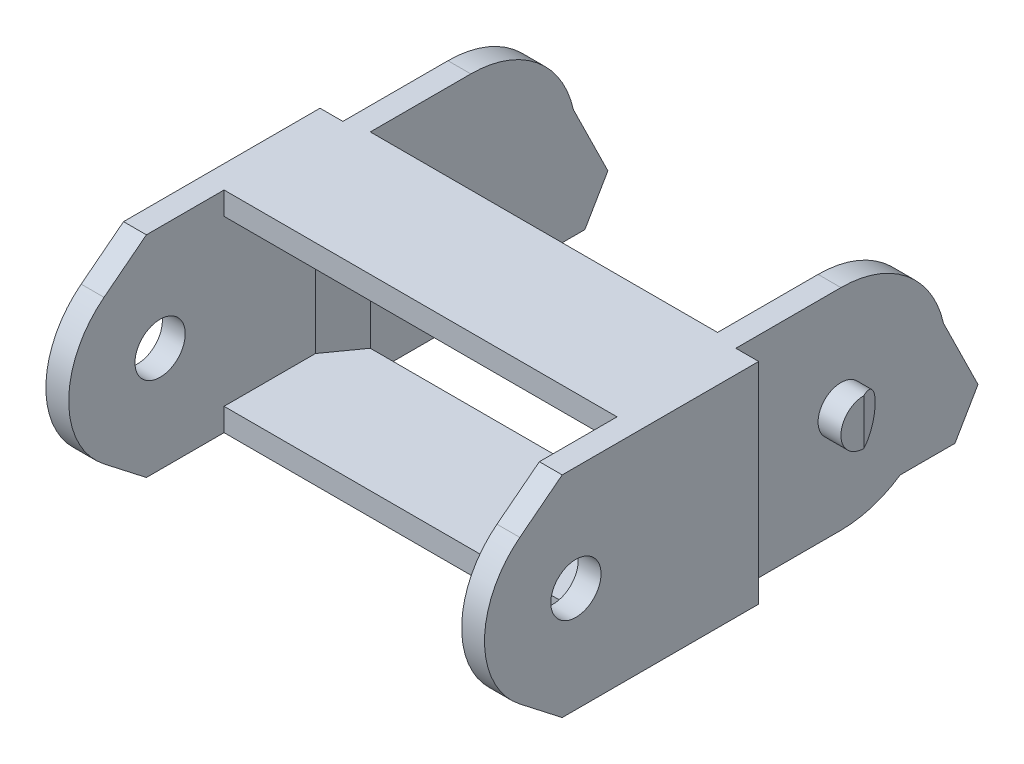
from build123d import *

# Parameters (mm, degrees)
BOSS_EXTRUDE1_DEPTH = 24
SKETCH2_W           = 23
SKETCH2_H           = 23
CUT_EXTRUDE1_DEPTH  = 2.5
SKETCH4_W           = 43
SKETCH4_H           = 17
CUT_EXTRUDE2_DEPTH  = 44.462627624
SKETCH5_W           = 38
SKETCH5_H           = 22.5
CUT_EXTRUDE3_DEPTH  = 44.462627624
CUT_EXTRUDE4_DEPTH  = 9
SKETCH7_R           = 2.75
CUT_EXTRUDE5_DEPTH  = 57.747246629
SKETCH8_R           = 2.5
BOSS_EXTRUDE2_DEPTH = 2.5
CUT_EXTRUDE6_DEPTH  = 44.462627624
BOSS_EXTRUDE4_DEPTH = 2.5


with BuildPart() as part:
    # Sketch1 → Boss-Extrude1 (new, symmetric)
    with BuildSketch(Plane(origin=(0, 0, 0), x_dir=(0, 0, -1), z_dir=(1, 0, 0))):
        with BuildLine():
            Line((16.5, -11.5), (-16.5, -11.5))
            Line((-16.5, -11.5), (-21.137338715, -7.895129733))
            ThreePointArc((-21.137338715, -7.895129733), (-25, 0), (-21.137338715, 7.895129733))
            Line((-21.137338715, 7.895129733), (-16.5, 11.5))
            Line((-16.5, 11.5), (16.5, 11.5))
            ThreePointArc((16.5, 11.5), (28, 0), (16.5, -11.5))
        make_face()
    extrude(amount=BOSS_EXTRUDE1_DEPTH, both=True)

    # Sketch2 → Cut-Extrude1 (cut)
    with BuildSketch(Plane(origin=(24, 0, 0), x_dir=(0, 0, -1), z_dir=(1, 0, 0))):
        with Locations((16.5, 0)):
            Rectangle(SKETCH2_W, SKETCH2_H)
    cut_extrude1 = extrude(amount=-CUT_EXTRUDE1_DEPTH, mode=Mode.SUBTRACT)

    # Mirror1: Cut-Extrude1 across plane
    add(cut_extrude1.mirror(Plane(origin=(0, 0, 0), x_dir=(0, 0, 1), z_dir=(1, 0, 0))), mode=Mode.SUBTRACT)

    # Sketch4 → Cut-Extrude2 (cut, through all)
    with BuildSketch(Plane(origin=(0, 11.5, 0), x_dir=(1, 0, 0), z_dir=(0, 1, 0))):
        with Locations((0, -16.5)):
            Rectangle(SKETCH4_W, SKETCH4_H)
    extrude(amount=-CUT_EXTRUDE2_DEPTH, mode=Mode.SUBTRACT)

    # Sketch5 → Cut-Extrude3 (cut, through all)
    with BuildSketch(Plane(origin=(0, 11.5, 0), x_dir=(1, 0, 0), z_dir=(0, 1, 0))):
        with Locations((0, 16.75)):
            Rectangle(SKETCH5_W, SKETCH5_H)
    extrude(amount=-CUT_EXTRUDE3_DEPTH, mode=Mode.SUBTRACT)

    # Sketch6 → Cut-Extrude4 (cut, symmetric)
    with BuildSketch(Plane(origin=(0, 0, 0), x_dir=(1, 0, 0), z_dir=(0, 1, 0))):
        Polygon((-19, 5.5), (-21.5, 2), (-21.5, -8), (21.5, -8), (21.5, 2), (19, 5.5), align=None)
    extrude(amount=CUT_EXTRUDE4_DEPTH, both=True, mode=Mode.SUBTRACT)

    # Sketch7 → Cut-Extrude5 (cut, through all)
    with BuildSketch(Plane(origin=(24, 0, 0), x_dir=(0, 0, -1), z_dir=(1, 0, 0))):
        with Locations((-15, 0)):
            Circle(SKETCH7_R)
    extrude(amount=-CUT_EXTRUDE5_DEPTH, mode=Mode.SUBTRACT)

    # Sketch8 → Boss-Extrude2 (add, through all)
    with BuildSketch(Plane(origin=(21.5, 0, 0), x_dir=(0, 0, -1), z_dir=(1, 0, 0))):
        with Locations((16.5, 0)):
            Circle(SKETCH8_R)
    boss_extrude2 = extrude(amount=BOSS_EXTRUDE2_DEPTH)

    # Sketch9 → Cut-Extrude6 (cut, through all)
    with BuildSketch(Plane(origin=(0, 11.5, 0), x_dir=(1, 0, 0), z_dir=(0, 1, 0))):
        Polygon((22.75, 19), (24, 16.5), (24, 19), align=None)
    cut_extrude6 = extrude(amount=-CUT_EXTRUDE6_DEPTH, mode=Mode.SUBTRACT)

    # Sketch10 → Boss-Extrude4 (add)
    with BuildSketch(Plane(origin=(21.5, 0, 0), x_dir=(0, 0, -1), z_dir=(1, 0, 0))):
        with BuildLine():
            Line((27.72497216, 2.5), (31.5, -5.181049598))
            Line((31.5, -5.181049598), (28.980740698, -9.5))
            Line((28.980740698, -9.5), (22.980740698, -9.5))
            ThreePointArc((22.980740698, -9.5), (27.194534443, -4.228112231), (27.72497216, 2.5))
        make_face()
    boss_extrude4 = extrude(amount=-BOSS_EXTRUDE4_DEPTH)

    # Mirror2: Boss-Extrude2, Cut-Extrude6, Boss-Extrude4 across plane
    add(boss_extrude2.mirror(Plane(origin=(0, 0, 0), x_dir=(0, 0, 1), z_dir=(1, 0, 0))))
    add(cut_extrude6.mirror(Plane(origin=(0, 0, 0), x_dir=(0, 0, 1), z_dir=(1, 0, 0))), mode=Mode.SUBTRACT)
    add(boss_extrude4.mirror(Plane(origin=(0, 0, 0), x_dir=(0, 0, 1), z_dir=(1, 0, 0))))


solid = part.part
